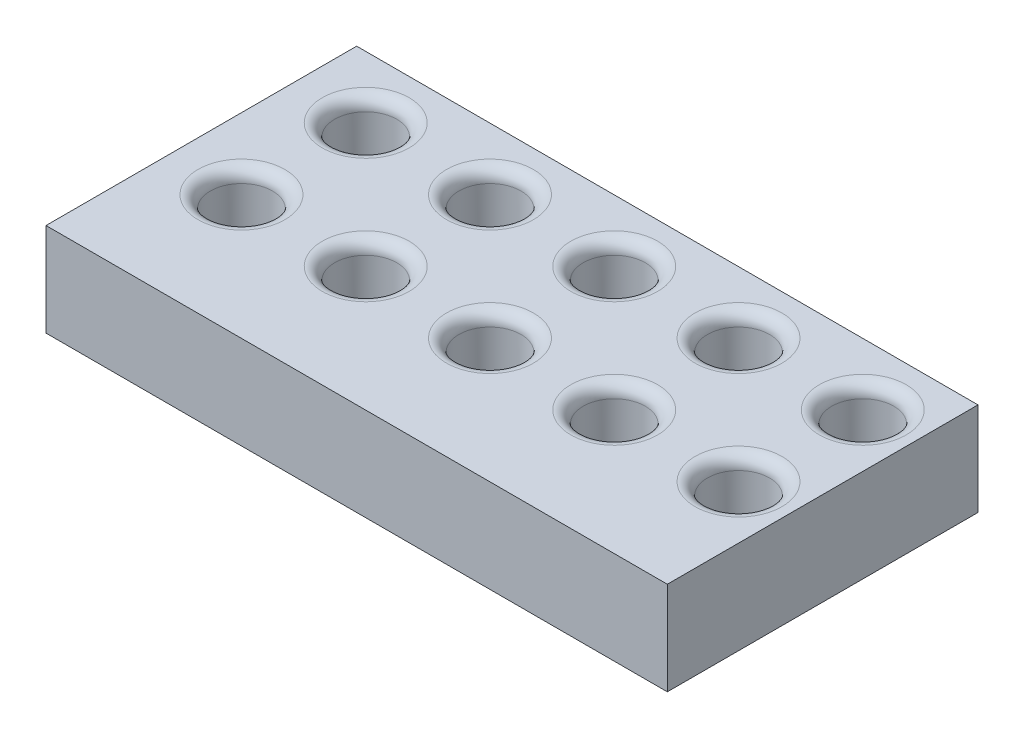
from build123d import *

# Parameters (mm, degrees)
SKETCH1_W           = 100
SKETCH1_H           = 50
BOSS_EXTRUDE1_DEPTH = 15
SKETCH2_R           = 5
CUT_EXTRUDE1_DEPTH  = 10
FILLET2_R           = 2


with BuildPart() as part:
    # Sketch1 → Boss-Extrude1 (new body)
    with BuildSketch(Plane(origin=(0, 0, 0), x_dir=(1, 0, 0), z_dir=(0, 1, 0))):
        Rectangle(SKETCH1_W, SKETCH1_H)
    extrude(amount=BOSS_EXTRUDE1_DEPTH)

    # Sketch2 → Cut-Extrude1 (cut)
    with BuildSketch(Plane(origin=(0, 15, 0), x_dir=(1, 0, 0), z_dir=(0, 1, 0))):
        with Locations(Location((-38.584884324, 15.041826829, 0), (0, 0, 270))):
            Circle(SKETCH2_R)
        with Locations(Location((-18.584884324, 15.041826829, 0), (0, 0, 270))):
            Circle(SKETCH2_R)
        with Locations(Location((1.415115676, 15.041826829, 0), (0, 0, 270))):
            Circle(SKETCH2_R)
        with Locations(Location((21.415115676, 15.041826829, 0), (0, 0, 270))):
            Circle(SKETCH2_R)
        with Locations(Location((41.415115676, 15.041826829, 0), (0, 0, 270))):
            Circle(SKETCH2_R)
        with Locations(Location((-18.584884324, -4.958173171, 0), (0, 0, 270))):
            Circle(SKETCH2_R)
        with Locations(Location((1.415115676, -4.958173171, 0), (0, 0, 270))):
            Circle(SKETCH2_R)
        with Locations(Location((21.415115676, -4.958173171, 0), (0, 0, 270))):
            Circle(SKETCH2_R)
        with Locations(Location((41.415115676, -4.958173171, 0), (0, 0, 270))):
            Circle(SKETCH2_R)
        with Locations(Location((-38.584884324, -4.958173171, 0), (0, 0, 270))):
            Circle(SKETCH2_R)
    extrude(amount=-CUT_EXTRUDE1_DEPTH, mode=Mode.SUBTRACT)

    # Fillet2
    fillet2_edges = [part.edges().sort_by_distance(p)[0] for p in [
        (-38.584884324, 15, -0.041826829),
        (41.415115676, 15, -0.041826829),
        (21.415115676, 15, -0.041826829),
        (1.415115676, 15, -0.041826829),
        (-18.584884324, 15, -0.041826829),
        (41.415115676, 15, -20.041826829),
        (21.415115676, 15, -20.041826829),
        (1.415115676, 15, -20.041826829),
        (-18.584884324, 15, -20.041826829),
        (-38.584884324, 15, -20.041826829),
    ]]
    fillet(fillet2_edges, radius=FILLET2_R)


solid = part.part
